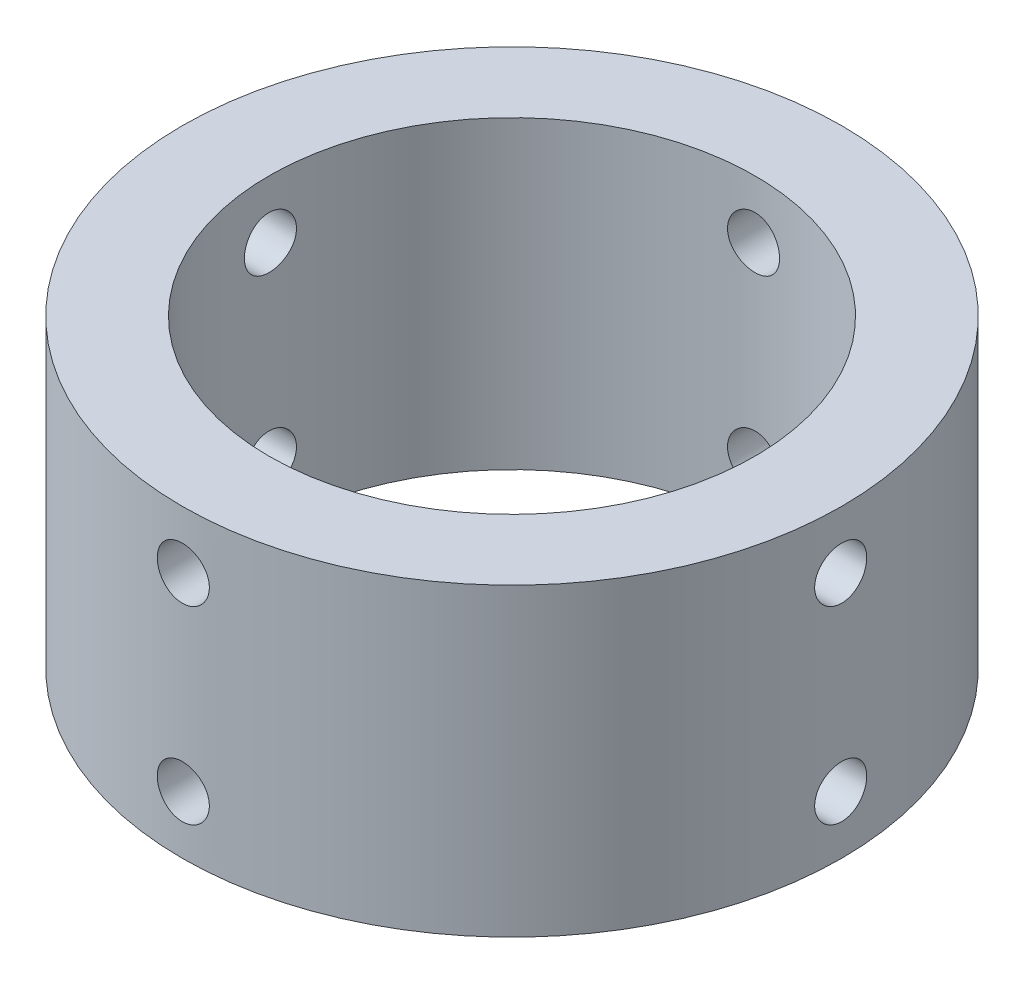
from build123d import *

# Parameters (mm, degrees)
SKETCH1_R           = 28.5
SKETCH1_R_2         = 21
BOSS_EXTRUDE1_DEPTH = 13.175
SKETCH2_R           = 2.25
CUT_EXTRUDE1_DEPTH  = 43.403780787
CIRPATTERN1_COUNT   = 4


with BuildPart() as part:
    # Sketch1 → Boss-Extrude1 (new, symmetric)
    with BuildSketch(Plane(origin=(0, 0, 0), x_dir=(1, 0, 0), z_dir=(0, 1, 0))):
        with Locations(Location((0, 0, 0), (0, 0, 90))):
            Circle(SKETCH1_R)
        with Locations(Location((0, 0, 0), (0, 0, 90))):
            Circle(SKETCH1_R_2, mode=Mode.SUBTRACT)
    extrude(amount=BOSS_EXTRUDE1_DEPTH, both=True)

    # Sketch2 → Cut-Extrude1 (cut, through all)
    with BuildSketch(Plane.XY):
        with Locations(Location((0, 8.175, 0), (0, 0, 90))):
            Circle(SKETCH2_R)
        with Locations(Location((0, -8.175, 0), (0, 0, 90))):
            Circle(SKETCH2_R)
    cut_extrude1 = extrude(amount=-CUT_EXTRUDE1_DEPTH, mode=Mode.SUBTRACT)

    # CirPattern1: Cut-Extrude1 ×4 about axis
    cirpattern1_axis = Axis((0, 13.175, 0), (0, -1, 0))
    for i in range(1, CIRPATTERN1_COUNT):
        add(cut_extrude1.rotate(cirpattern1_axis, i * 360 / CIRPATTERN1_COUNT), mode=Mode.SUBTRACT)


solid = part.part
